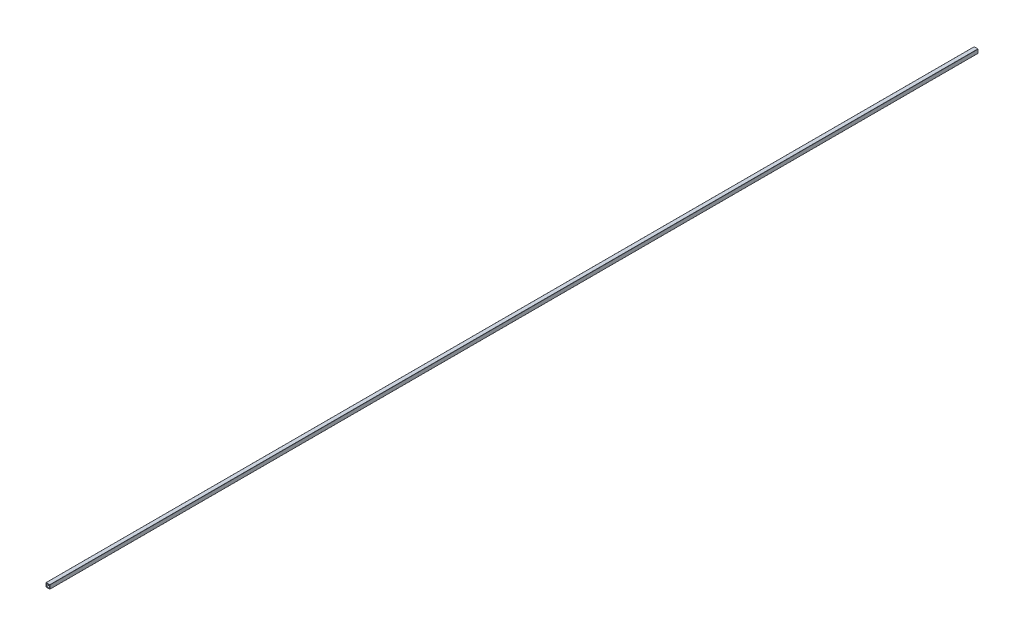
from build123d import *

# Parameters (mm, degrees)
CROQUIS1_W              = 18.56
CROQUIS1_H              = 18.56
SALIENTE_EXTRUIR1_DEPTH = 6000


with BuildPart() as part:
    # Croquis1 → Saliente-Extruir1 (new body)
    with BuildSketch(Plane.XY):
        with BuildLine():
            Line((-11.7, -12.7), (11.7, -12.7))
            ThreePointArc((11.7, -12.7), (12.407106781, -12.407106781), (12.7, -11.7))
            Line((12.7, -11.7), (12.7, 11.7))
            ThreePointArc((12.7, 11.7), (12.407106781, 12.407106781), (11.7, 12.7))
            Line((11.7, 12.7), (-11.7, 12.7))
            ThreePointArc((-11.7, 12.7), (-12.407106781, 12.407106781), (-12.7, 11.7))
            Line((-12.7, 11.7), (-12.7, -11.7))
            ThreePointArc((-12.7, -11.7), (-12.407106781, -12.407106781), (-11.7, -12.7))
        make_face()
        Rectangle(CROQUIS1_W, CROQUIS1_H, mode=Mode.SUBTRACT)
    extrude(amount=SALIENTE_EXTRUIR1_DEPTH)


solid = part.part
